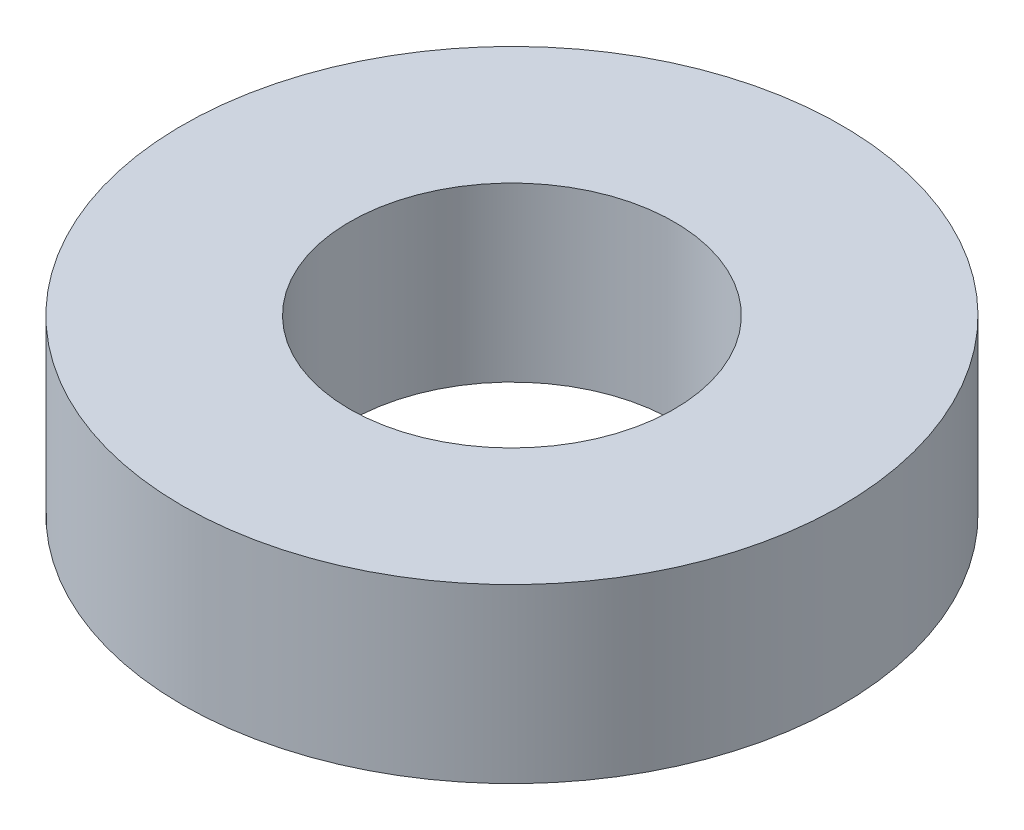
from build123d import *

# Parameters (mm, degrees)
SKETCH_1_R      = 3.25
SKETCH_1_R_2    = 1.6
EXTRUDE_1_DEPTH = 1.7


with BuildPart() as part:
    # 草图1 → 凸台-拉伸1 (new body)
    with BuildSketch(Plane(origin=(0, 0, 0), x_dir=(1, 0, 0), z_dir=(0, 1, 0))):
        with Locations(Location((0, 0, 0), (0, 0, 270))):
            Circle(SKETCH_1_R)
        with Locations(Location((0, 0, 0), (0, 0, 270))):
            Circle(SKETCH_1_R_2, mode=Mode.SUBTRACT)
    extrude(amount=EXTRUDE_1_DEPTH)


solid = part.part
